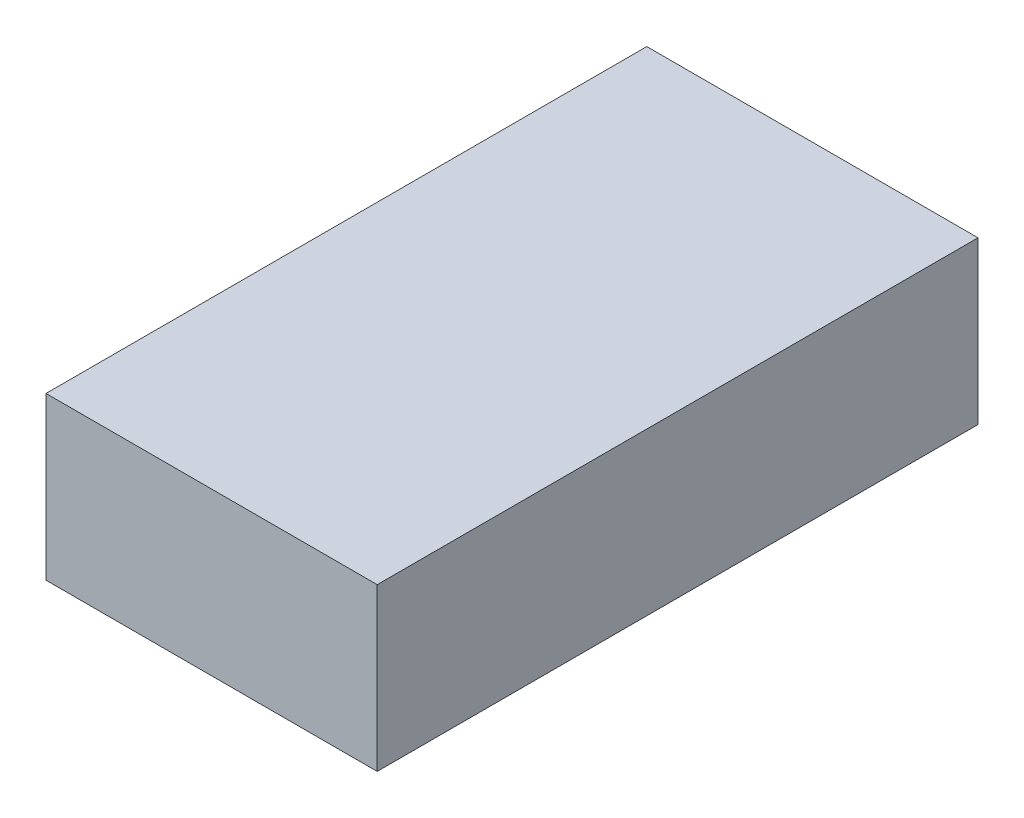
from build123d import *

# Parameters (mm, degrees)
SKETCH1_W           = 43
SKETCH1_H           = 78
BOSS_EXTRUDE1_DEPTH = 21


with BuildPart() as part:
    # Sketch1 → Boss-Extrude1 (new body)
    with BuildSketch(Plane(origin=(0, 0, 0), x_dir=(1, 0, 0), z_dir=(0, 1, 0))):
        Rectangle(SKETCH1_W, SKETCH1_H)
    extrude(amount=BOSS_EXTRUDE1_DEPTH)


solid = part.part
